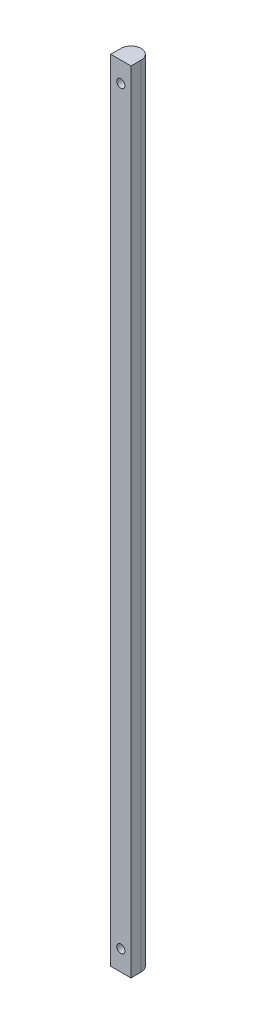
from build123d import *

# Parameters (mm, degrees)
BOSS_EXTRUDE1_DEPTH   = 123.825
F_5_40_TAPPED_HOLE1_D = 2.5781


with BuildPart() as part:
    # Sketch1 → Boss-Extrude1 (new, symmetric)
    with BuildSketch(Plane(origin=(0, 0, 0), x_dir=(1, 0, 0), z_dir=(0, 1, 0))):
        with BuildLine():
            Line((-3.175, 3.175), (-3.175, 0))
            Line((-3.175, 0), (3.175, 0))
            Line((3.175, 0), (3.175, 3.175))
            ThreePointArc((3.175, 3.175), (0, 6.35), (-3.175, 3.175))
        make_face()
    extrude(amount=BOSS_EXTRUDE1_DEPTH, both=True)

    # #5-40 Tapped Hole1 (through all)
    with Locations(Plane.XY):
        with Locations((0, -117.475)):
            f_5_40_tapped_hole1 = Hole(F_5_40_TAPPED_HOLE1_D / 2)

    # Mirror1: #5-40 Tapped Hole1 across plane
    add(f_5_40_tapped_hole1.mirror(Plane.ZX), mode=Mode.SUBTRACT)


solid = part.part
